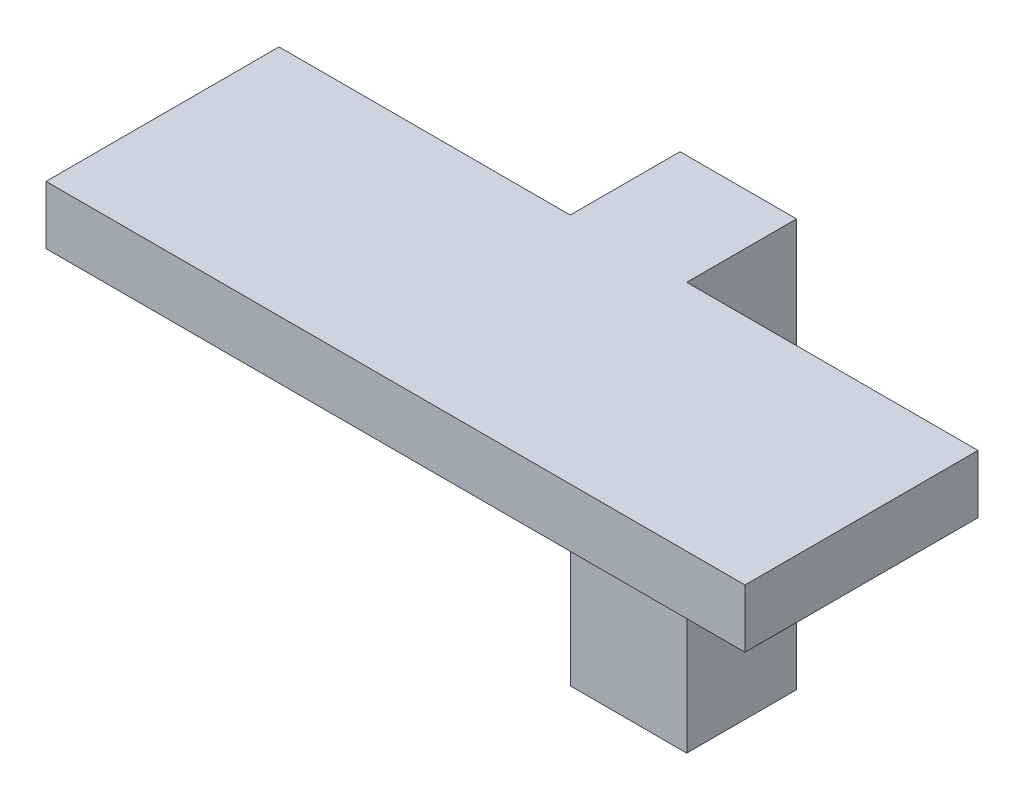
from build123d import *

# Parameters (mm, degrees)
BOSS_EXTRUDE1_DEPTH = 5
BOSS_EXTRUDE2_DEPTH = 30


with BuildPart() as part:
    # Sketch2 → Boss-Extrude1 (new body)
    with BuildSketch(Plane(origin=(0, 0, 0), x_dir=(1, 0, 0), z_dir=(0, 1, 0))):
        Polygon((-5, 10), (-30, 10), (-30, -10), (30, -10), (30, 10), (5, 10), (5, 19.423036009), (-5, 19.423036009), align=None)
    extrude(amount=BOSS_EXTRUDE1_DEPTH)

    # Sketch2<3> → Boss-Extrude2 (add)
    with BuildSketch(Plane(origin=(0, 0, 0), x_dir=(1, 0, 0), z_dir=(0, 1, 0))):
        Polygon((-5, 19.423036009), (-5, 10), (0, 10), (5, 10), (5, 19.423036009), align=None)
    extrude(amount=-BOSS_EXTRUDE2_DEPTH)


solid = part.part
